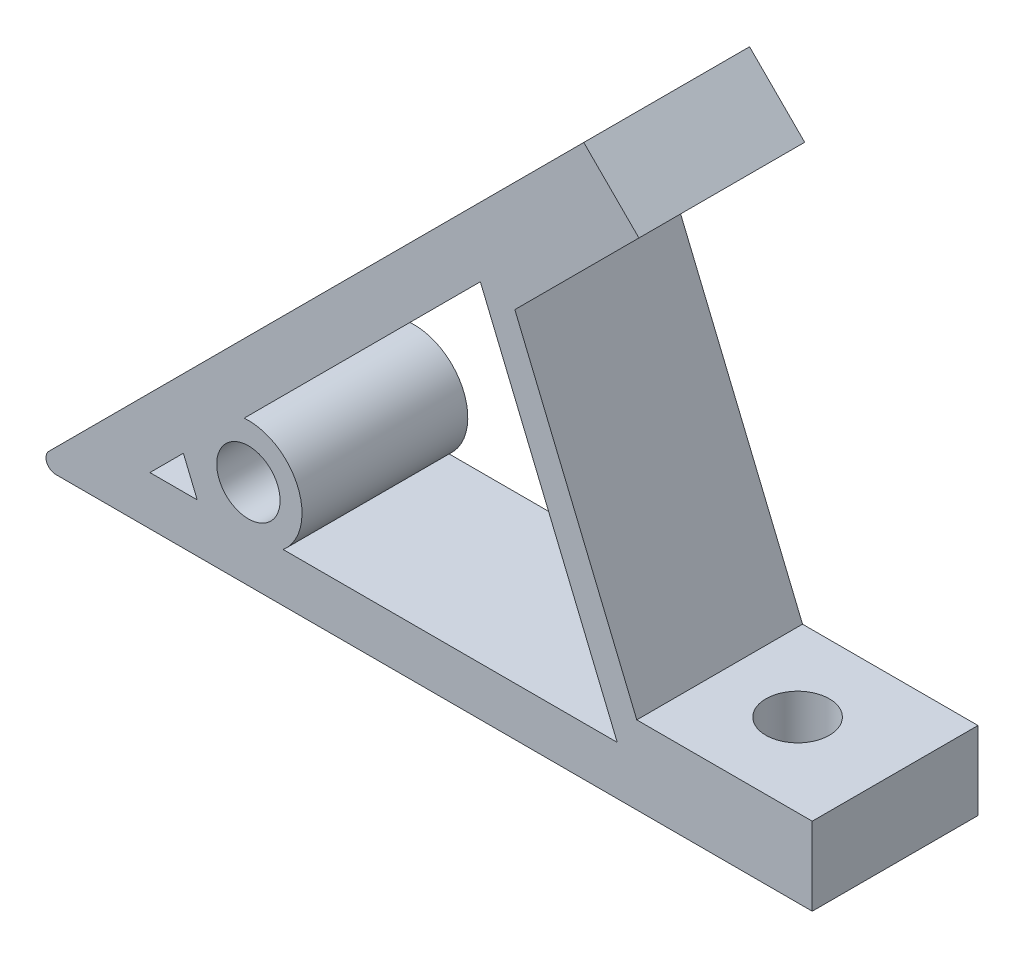
from build123d import *

# Parameters (mm, degrees)
SKETCH_1_R          = 3.25
EXTRUDE_1_DEPTH     = 8.5
SKETCH_3_R          = 3.25
CUT_EXTRUDE_1_DEPTH = 17


with BuildPart() as part:
    # 草图1 → 凸台-拉伸1 (new, symmetric)
    with BuildSketch(Plane.XY):
        with BuildLine():
            Line((-77.585786438, 0), (0, 0))
            Line((0, 0), (0, 8))
            Line((0, 8), (-17.995464086, 8))
            Line((-17.995464086, 8), (-30.499317942, 38.186973559))
            Line((-30.499317942, 38.186973559), (-17.774603256, 50.911688245))
            Line((-17.774603256, 50.911688245), (-23.431457505, 56.568542495))
            Line((-23.431457505, 56.568542495), (-78.292893219, 1.707106781))
            ThreePointArc((-78.292893219, 1.707106781), (-78.50966597, 0.617316568), (-77.585786438, 0))
        make_face()
        with Locations((-57.82689122, 9.184402377)):
            Circle(SKETCH_1_R, mode=Mode.SUBTRACT)
        Polygon((-67.928932188, 5), (-63.07447047, 5), (-64.496309389, 8.4326228), align=None, mode=Mode.SUBTRACT)
        with BuildLine():
            Line((-54.257468753, 5), (-20, 5))
            Line((-20, 5), (-34.038059223, 38.890872965))
            Line((-34.038059223, 38.890872965), (-58.261747684, 14.667184504))
            ThreePointArc((-58.261747684, 14.667184504), (-52.745553791, 11.289161255), (-54.257468753, 5))
        make_face(mode=Mode.SUBTRACT)
    extrude(amount=EXTRUDE_1_DEPTH, both=True)

    # 草图3 → 切除-拉伸1 (cut)
    with BuildSketch(Plane(origin=(0, 8, 0), x_dir=(1, 0, 0), z_dir=(0, 1, 0))):
        with Locations(Location((-10, 0, 0), (0, 0, 180))):
            Circle(SKETCH_3_R)
    cut_extrude_1 = extrude(amount=-CUT_EXTRUDE_1_DEPTH, mode=Mode.SUBTRACT)

    # 镜向1: 切除-拉伸1 across plane
    add(cut_extrude_1.mirror(Plane(origin=(-11.715728753, 28.284271247, 0), x_dir=(0, 0, 1), z_dir=(-0.3826834323650881, 0.9238795325112875, 0))), mode=Mode.SUBTRACT)


solid = part.part
